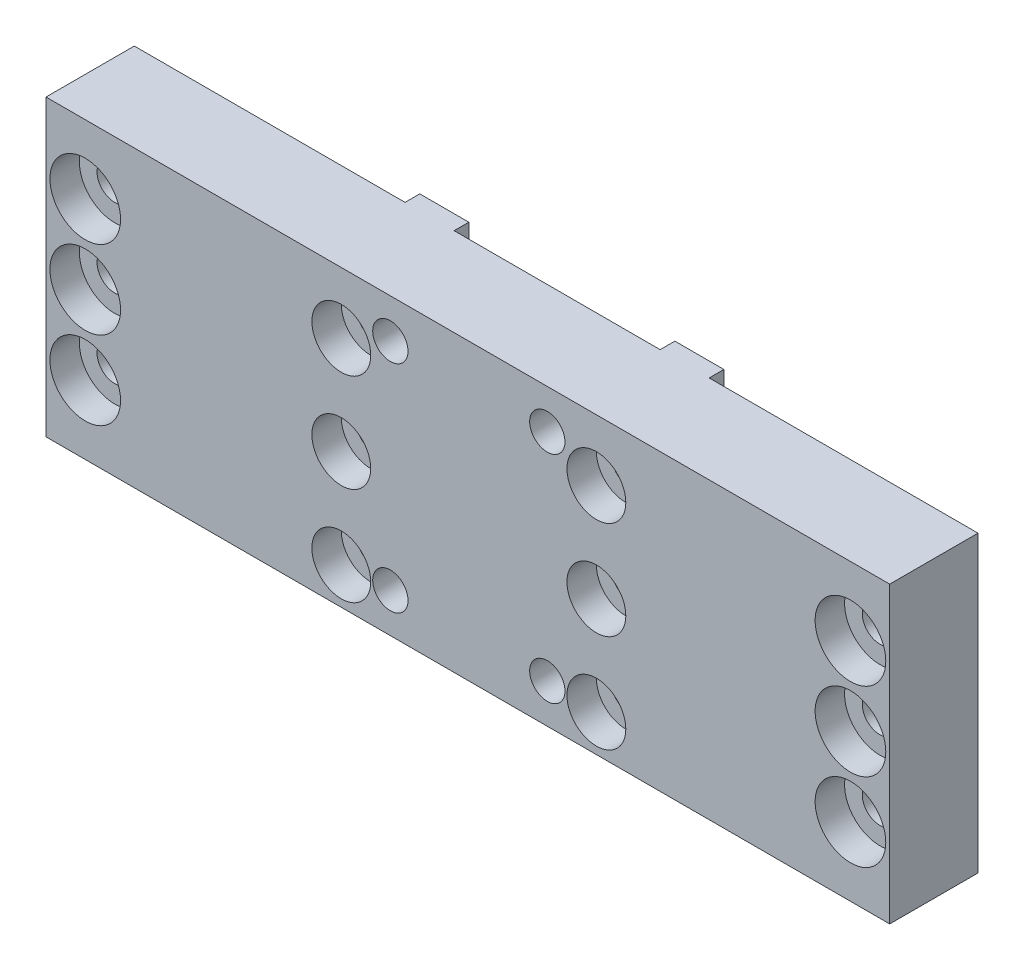
from build123d import *

# Parameters (mm, degrees)
SKETCH_1_W           = 70
SKETCH_1_H           = 30
EXTRUDE_1_DEPTH      = 9
SKETCH_2_W           = 112.1
SKETCH_2_H           = 30
EXTRUDE_2_DEPTH      = 8
SKETCH_3_W           = 42.6
SKETCH_3_H           = 30
EXTRUDE_3_DEPTH      = 8
SKETCH_5_W           = 18.5
SKETCH_5_H           = 30
SKETCH_5_R           = 2
EXTRUDE_4_DEPTH      = 5.5
SKETCH_11_R          = 2
CUT_EXTRUDE_4_DEPTH  = 8
SKETCH_12_R          = 1.8
CUT_EXTRUDE_6_DEPTH  = 8
SKETCH_13_R          = 2
CUT_EXTRUDE_7_DEPTH  = 8
SKETCH_14_R          = 2
CUT_EXTRUDE_8_DEPTH  = 10
SKETCH_19_W          = 5
SKETCH_19_H          = 9
EXTRUDE_6_DEPTH      = 36.25
SKETCH_20_W          = 5
SKETCH_20_H          = 6.25
EXTRUDE_7_DEPTH      = 9
SKETCH_21_R          = 1.3
CUT_EXTRUDE_10_DEPTH = 9
SKETCH_25_W          = 5
SKETCH_25_H          = 1.5
EXTRUDE_8_DEPTH      = 42.5
SKETCH_26_R          = 1.3
CUT_EXTRUDE_14_DEPTH = 1.5
SKETCH_27_W          = 5
SKETCH_27_H          = 6.25
CUT_EXTRUDE_15_DEPTH = 11
SKETCH_28_R          = 3
CUT_EXTRUDE_16_DEPTH = 3
SKETCH_29_W          = 8
SKETCH_29_H          = 103.1
SKETCH_29_W_2        = 10.5
SKETCH_29_H_2        = 5.5
CUT_EXTRUDE_17_DEPTH = 30
SKETCH_30_R          = 1.8
CUT_EXTRUDE_18_DEPTH = 10
SKETCH_31_R          = 3.6
CUT_EXTRUDE_19_DEPTH = 3
SKETCH_32_R          = 1.8
CUT_EXTRUDE_20_DEPTH = 10
SKETCH_33_R          = 3.6
CUT_EXTRUDE_21_DEPTH = 3
CUT_EXTRUDE_22_REACH = 86.054
SKETCH_35_R          = 1.8


with BuildPart() as part:
    # 草圖1 → 填料-伸長1 (new body)
    with BuildSketch(Plane.XY):
        with Locations((35, 15)):
            Rectangle(SKETCH_1_W, SKETCH_1_H)
    extrude(amount=EXTRUDE_1_DEPTH)

    # 草圖2 → 填料-伸長2 (add)
    with BuildSketch(Plane.ZY):
        with Locations((-47.05, 15)):
            Rectangle(SKETCH_2_W, SKETCH_2_H)
    extrude(amount=EXTRUDE_2_DEPTH)

    # 草圖3 → 填料-伸長3 (add)
    with BuildSketch(Plane(origin=(70, 0, 0), x_dir=(0, 0, -1), z_dir=(1, 0, 0))):
        with Locations((12.3, 15)):
            Rectangle(SKETCH_3_W, SKETCH_3_H)
    extrude(amount=EXTRUDE_3_DEPTH)

    # 草圖5 → 填料-伸長4 (add)
    with BuildSketch(Plane(origin=(0, 0, -33.6), x_dir=(-1, 0, 0), z_dir=(0, 0, -1))):
        with Locations((-68.75, 15)):
            Rectangle(SKETCH_5_W, SKETCH_5_H)
        with Locations(Location((-65.75, 26, 0), (0, 0, 90))):
            Circle(SKETCH_5_R, mode=Mode.SUBTRACT)
        with Locations(Location((-65.75, 18, 0), (0, 0, 90))):
            Circle(SKETCH_5_R, mode=Mode.SUBTRACT)
        with Locations(Location((-65.75, 10, 0), (0, 0, 90))):
            Circle(SKETCH_5_R, mode=Mode.SUBTRACT)
    extrude(amount=EXTRUDE_4_DEPTH)

    # 草圖11 → 除料-伸長4 (cut)
    with BuildSketch(Plane.ZY.offset(8)):
        with Locations((-23, 23)):
            Circle(SKETCH_11_R)
        with Locations((-23, 15)):
            Circle(SKETCH_11_R)
        with Locations((-23, 7)):
            Circle(SKETCH_11_R)
        with Locations((-15, 23)):
            Circle(SKETCH_11_R)
        with Locations((-15, 15)):
            Circle(SKETCH_11_R)
        with Locations((-15, 7)):
            Circle(SKETCH_11_R)
        with Locations((-7, 23)):
            Circle(SKETCH_11_R)
        with Locations((-7, 15)):
            Circle(SKETCH_11_R)
        with Locations((-7, 7)):
            Circle(SKETCH_11_R)
    extrude(amount=-CUT_EXTRUDE_4_DEPTH, mode=Mode.SUBTRACT)

    # 草圖12 → 除料-伸長6 (cut)
    with BuildSketch(Plane(origin=(0, 0, -103.1), x_dir=(-1, 0, 0), z_dir=(0, 0, -1))):
        with Locations((3, 23)):
            Circle(SKETCH_12_R)
        with Locations((3, 15)):
            Circle(SKETCH_12_R)
        with Locations((3, 7)):
            Circle(SKETCH_12_R)
    extrude(amount=-CUT_EXTRUDE_6_DEPTH, mode=Mode.SUBTRACT)

    # 草圖13 → 除料-伸長7 (cut)
    with BuildSketch(Plane(origin=(78, 0, 0), x_dir=(0, 0, -1), z_dir=(1, 0, 0))):
        with Locations((9.1, 23)):
            Circle(SKETCH_13_R)
        with Locations((9.1, 15)):
            Circle(SKETCH_13_R)
        with Locations((9.1, 7)):
            Circle(SKETCH_13_R)
        with Locations((17.1, 23)):
            Circle(SKETCH_13_R)
        with Locations((17.1, 15)):
            Circle(SKETCH_13_R)
        with Locations((17.1, 7)):
            Circle(SKETCH_13_R)
        with Locations((25.1, 23)):
            Circle(SKETCH_13_R)
        with Locations((25.1, 15)):
            Circle(SKETCH_13_R)
        with Locations((25.1, 7)):
            Circle(SKETCH_13_R)
    extrude(amount=-CUT_EXTRUDE_7_DEPTH, mode=Mode.SUBTRACT)

    # 草圖14 → 除料-伸長8 (cut)
    with BuildSketch(Plane.ZY.offset(8)):
        with Locations((-85.1, 23)):
            Circle(SKETCH_14_R)
        with Locations((-85.1, 15)):
            Circle(SKETCH_14_R)
        with Locations((-85.1, 7)):
            Circle(SKETCH_14_R)
        with Locations((-77.1, 23)):
            Circle(SKETCH_14_R)
        with Locations((-77.1, 15)):
            Circle(SKETCH_14_R)
        with Locations((-77.1, 7)):
            Circle(SKETCH_14_R)
        with Locations((-69.1, 23)):
            Circle(SKETCH_14_R)
        with Locations((-69.1, 15)):
            Circle(SKETCH_14_R)
        with Locations((-69.1, 7)):
            Circle(SKETCH_14_R)
        with Locations((-61.1, 23)):
            Circle(SKETCH_14_R)
        with Locations((-61.1, 15)):
            Circle(SKETCH_14_R)
        with Locations((-61.1, 7)):
            Circle(SKETCH_14_R)
    extrude(amount=-CUT_EXTRUDE_8_DEPTH, mode=Mode.SUBTRACT)

    # 草圖19 → 填料-伸長6 (add)
    with BuildSketch(Plane(origin=(0, 30, 0), x_dir=(1, 0, 0), z_dir=(0, 1, 0))):
        with Locations((22.1, -4.5)):
            Rectangle(SKETCH_19_W, SKETCH_19_H)
        with Locations((48.1, -4.5)):
            Rectangle(SKETCH_19_W, SKETCH_19_H)
    extrude(amount=-EXTRUDE_6_DEPTH)

    # 草圖20 → 填料-伸長7 (add)
    with BuildSketch(Plane(origin=(0, 0, 0), x_dir=(-1, 0, 0), z_dir=(0, 0, -1))):
        with Locations((-48.1, 33.125)):
            Rectangle(SKETCH_20_W, SKETCH_20_H)
        with Locations((-22.1, 33.125)):
            Rectangle(SKETCH_20_W, SKETCH_20_H)
    extrude(amount=-EXTRUDE_7_DEPTH)

    # 草圖21 → 除料-伸長10 (cut)
    with BuildSketch(Plane(origin=(0, 0, 0), x_dir=(-1, 0, 0), z_dir=(0, 0, -1))):
        with Locations((-48.1, 23.75)):
            Circle(SKETCH_21_R)
        with Locations((-48.1, 13.75)):
            Circle(SKETCH_21_R)
        with Locations((-48.1, 3.75)):
            Circle(SKETCH_21_R)
        with Locations((-22.1, 23.75)):
            Circle(SKETCH_21_R)
        with Locations((-22.1, 13.75)):
            Circle(SKETCH_21_R)
        with Locations((-22.1, 3.75)):
            Circle(SKETCH_21_R)
    extrude(amount=-CUT_EXTRUDE_10_DEPTH, mode=Mode.SUBTRACT)

    # 草圖25 → 填料-伸長8 (add)
    with BuildSketch(Plane(origin=(0, 36.25, 0), x_dir=(1, 0, 0), z_dir=(0, 1, 0))):
        with Locations((22.1, 0.75)):
            Rectangle(SKETCH_25_W, SKETCH_25_H)
        with Locations((48.1, 0.75)):
            Rectangle(SKETCH_25_W, SKETCH_25_H)
    extrude(amount=-EXTRUDE_8_DEPTH)

    # 草圖26 → 除料-伸長14 (cut)
    with BuildSketch(Plane(origin=(0, 0, -1.5), x_dir=(-1, 0, 0), z_dir=(0, 0, -1))):
        with Locations((-48.1, 23.75)):
            Circle(SKETCH_26_R)
        with Locations((-48.1, 13.75)):
            Circle(SKETCH_26_R)
        with Locations((-48.1, 3.75)):
            Circle(SKETCH_26_R)
        with Locations((-22.1, 23.75)):
            Circle(SKETCH_26_R)
        with Locations((-22.1, 13.75)):
            Circle(SKETCH_26_R)
        with Locations((-22.1, 3.75)):
            Circle(SKETCH_26_R)
    extrude(amount=-CUT_EXTRUDE_14_DEPTH, mode=Mode.SUBTRACT)

    # 草圖27 → 除料-伸長15 (cut)
    with BuildSketch(Plane.XY.offset(9)):
        with Locations((22.1, 33.125)):
            Rectangle(SKETCH_27_W, SKETCH_27_H)
        with Locations((48.1, 33.125)):
            Rectangle(SKETCH_27_W, SKETCH_27_H)
        with Locations((22.1, -3.125)):
            Rectangle(SKETCH_27_W, SKETCH_27_H)
        with Locations((48.1, -3.125)):
            Rectangle(SKETCH_27_W, SKETCH_27_H)
    extrude(amount=-CUT_EXTRUDE_15_DEPTH, mode=Mode.SUBTRACT)

    # 草圖28 → 除料-伸長16 (cut)
    with BuildSketch(Plane.XY.offset(9)):
        with Locations((22.1, 23.75)):
            Circle(SKETCH_28_R)
        with Locations((22.1, 13.75)):
            Circle(SKETCH_28_R)
        with Locations((22.1, 3.75)):
            Circle(SKETCH_28_R)
        with Locations((48.1, 13.75)):
            Circle(SKETCH_28_R)
        with Locations((48.1, 3.75)):
            Circle(SKETCH_28_R)
        with Locations((48.1, 23.75)):
            Circle(SKETCH_28_R)
    extrude(amount=-CUT_EXTRUDE_16_DEPTH, mode=Mode.SUBTRACT)

    # 草圖29 → 除料-伸長17 (cut)
    with BuildSketch(Plane(origin=(0, 30, 0), x_dir=(1, 0, 0), z_dir=(0, 1, 0))):
        with Locations((-4, 51.55)):
            Rectangle(SKETCH_29_W, SKETCH_29_H)
        with Locations((64.75, 36.35)):
            Rectangle(SKETCH_29_W_2, SKETCH_29_H_2)
        Polygon((70, 33.6), (70, 0), (78, 0), (78, 39.1), (70, 39.1), align=None)
    extrude(amount=-CUT_EXTRUDE_17_DEPTH, mode=Mode.SUBTRACT)

    # 草圖30 → 除料-伸長18 (cut)
    with BuildSketch(Plane.XY.offset(9)):
        with Locations((-4, 23)):
            Circle(SKETCH_30_R)
        with Locations((-4, 15)):
            Circle(SKETCH_30_R)
        with Locations((-4, 7)):
            Circle(SKETCH_30_R)
    extrude(amount=-CUT_EXTRUDE_18_DEPTH, mode=Mode.SUBTRACT)

    # 草圖31 → 除料-伸長19 (cut)
    with BuildSketch(Plane.XY.offset(9)):
        with Locations((-4, 15)):
            Circle(SKETCH_31_R)
        with Locations((-4, 7)):
            Circle(SKETCH_31_R)
        with Locations((-4, 23)):
            Circle(SKETCH_31_R)
    extrude(amount=-CUT_EXTRUDE_19_DEPTH, mode=Mode.SUBTRACT)

    # 草圖32 → 除料-伸長20 (cut)
    with BuildSketch(Plane.XY.offset(9)):
        with Locations((74, 23)):
            Circle(SKETCH_32_R)
        with Locations((74, 15)):
            Circle(SKETCH_32_R)
        with Locations((74, 7)):
            Circle(SKETCH_32_R)
    extrude(amount=-CUT_EXTRUDE_20_DEPTH, mode=Mode.SUBTRACT)

    # 草圖33 → 除料-伸長21 (cut)
    with BuildSketch(Plane.XY.offset(9)):
        with Locations((74, 23)):
            Circle(SKETCH_33_R)
        with Locations((74, 15)):
            Circle(SKETCH_33_R)
        with Locations((74, 7)):
            Circle(SKETCH_33_R)
    extrude(amount=-CUT_EXTRUDE_21_DEPTH, mode=Mode.SUBTRACT)

    # 草圖35 → 除料-伸長22 (cut, up to next)
    with BuildSketch(Plane(origin=(0, 0, 0), x_dir=(-1, 0, 0), z_dir=(0, 0, -1)), mode=Mode.PRIVATE) as cut_extrude_22_sk1:
        with Locations((-43.1, 4)):
            Circle(SKETCH_35_R)
    cut_extrude_22_tool1 = extrude(cut_extrude_22_sk1.sketch, amount=-CUT_EXTRUDE_22_REACH, mode=Mode.PRIVATE) & part.part
    # 草圖35 → 除料-伸長22 (cut, up to next)
    with BuildSketch(Plane(origin=(0, 0, 0), x_dir=(-1, 0, 0), z_dir=(0, 0, -1)), mode=Mode.PRIVATE) as cut_extrude_22_sk2:
        with Locations((-43.1, 26)):
            Circle(SKETCH_35_R)
    cut_extrude_22_tool2 = extrude(cut_extrude_22_sk2.sketch, amount=-CUT_EXTRUDE_22_REACH, mode=Mode.PRIVATE) & part.part
    # 草圖35 → 除料-伸長22 (cut, up to next)
    with BuildSketch(Plane(origin=(0, 0, 0), x_dir=(-1, 0, 0), z_dir=(0, 0, -1)), mode=Mode.PRIVATE) as cut_extrude_22_sk3:
        with Locations((-27.1, 26)):
            Circle(SKETCH_35_R)
    cut_extrude_22_tool3 = extrude(cut_extrude_22_sk3.sketch, amount=-CUT_EXTRUDE_22_REACH, mode=Mode.PRIVATE) & part.part
    # 草圖35 → 除料-伸長22 (cut, up to next)
    with BuildSketch(Plane(origin=(0, 0, 0), x_dir=(-1, 0, 0), z_dir=(0, 0, -1)), mode=Mode.PRIVATE) as cut_extrude_22_sk4:
        with Locations((-27.1, 4)):
            Circle(SKETCH_35_R)
    cut_extrude_22_tool4 = extrude(cut_extrude_22_sk4.sketch, amount=-CUT_EXTRUDE_22_REACH, mode=Mode.PRIVATE) & part.part
    add(cut_extrude_22_tool1.solids().sort_by_distance((43.1, 4, 0))[0], mode=Mode.SUBTRACT)
    add(cut_extrude_22_tool2.solids().sort_by_distance((43.1, 26, 0))[0], mode=Mode.SUBTRACT)
    add(cut_extrude_22_tool3.solids().sort_by_distance((27.1, 26, 0))[0], mode=Mode.SUBTRACT)
    add(cut_extrude_22_tool4.solids().sort_by_distance((27.1, 4, 0))[0], mode=Mode.SUBTRACT)


solid = part.part
